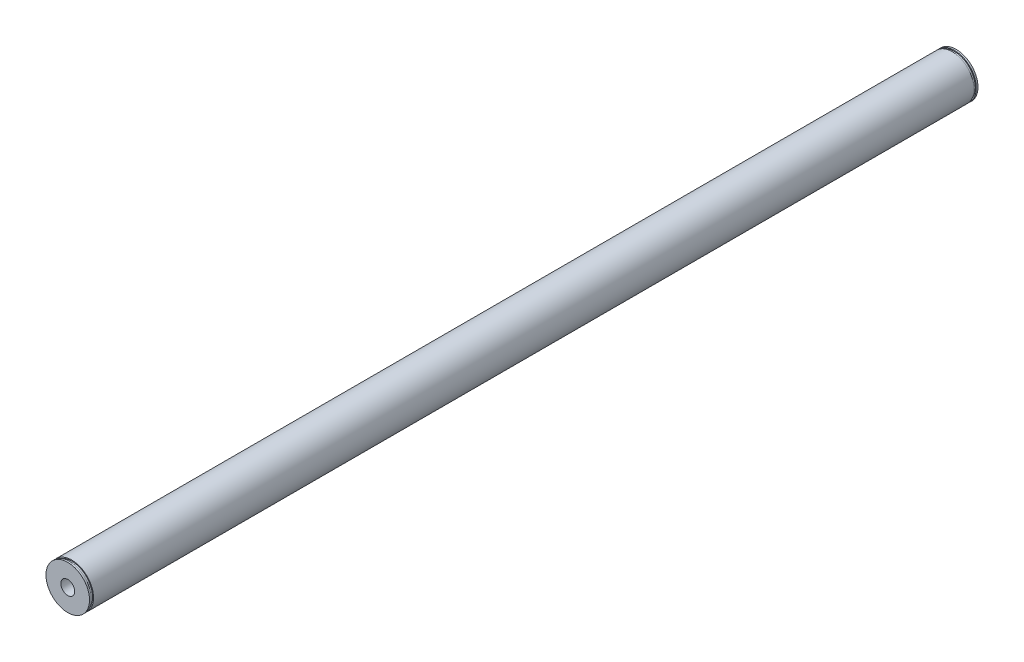
from build123d import *

# Parameters (mm, degrees)
SCHIZZO1_R               = 12.5
ESTRUSIONE1_DEPTH        = 510
SCHIZZO2_R               = 4
TAGLIO_ESTRUSIONE1_DEPTH = 30
TAGLIO_ESTRUSIONE2_START = -30
SCHIZZO3_R               = 4
TAGLIO_ESTRUSIONE2_DEPTH = 30
SCHIZZO5_W               = 1.3
SCHIZZO5_H               = 0.55


with BuildPart() as part:
    # Schizzo1 → Estrusione1 (new body)
    with BuildSketch(Plane.XY):
        Circle(SCHIZZO1_R)
    extrude(amount=ESTRUSIONE1_DEPTH)

    # Schizzo2 → Taglio-Estrusione1 (cut)
    with BuildSketch(Plane.XY.offset(510)):
        Circle(SCHIZZO2_R)
    extrude(amount=-TAGLIO_ESTRUSIONE1_DEPTH, mode=Mode.SUBTRACT)

    # Schizzo3 → Taglio-Estrusione2 (cut)
    with BuildSketch(Plane(origin=(0, 0, 0), x_dir=(-1, 0, 0), z_dir=(0, 0, -1)).offset(TAGLIO_ESTRUSIONE2_START)):
        with Locations(Location((0, 0, 0), (0, 0, 180))):
            Circle(SCHIZZO3_R)
    extrude(amount=TAGLIO_ESTRUSIONE2_DEPTH, mode=Mode.SUBTRACT)

    # Schizzo5 → Taglia-Rivoluzione1 (revolve, cut)
    with BuildSketch(Plane(origin=(0, 0, 0), x_dir=(0, 0, -1), z_dir=(1, 0, 0)), mode=Mode.PRIVATE) as taglia_rivoluzione1_sk:
        with Locations((-508.35, 12.225)):
            Rectangle(SCHIZZO5_W, SCHIZZO5_H)
        with Locations((-1.65, 12.225)):
            Rectangle(SCHIZZO5_W, SCHIZZO5_H)
    revolve(taglia_rivoluzione1_sk.sketch.rotate(Axis((0, 0, 510), (0, 0, -1)), 90), axis=Axis((0, 0, 510), (0, 0, -1)), mode=Mode.SUBTRACT)


solid = part.part
